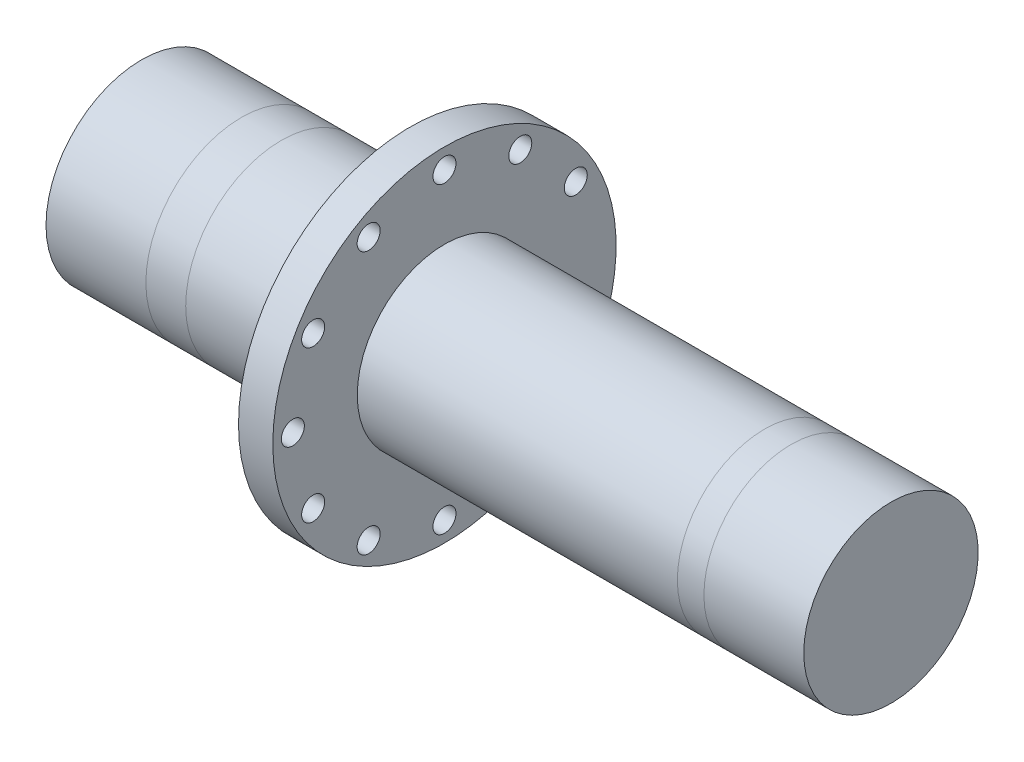
from build123d import *

# Parameters (mm, degrees)
M6_CLEARANCE_HOLE1_D = 6.6


with BuildPart() as part:
    # Sketch1 → Revolve1 (revolve)
    with BuildSketch(Plane(origin=(0, 0, 0), x_dir=(1, 0, 0), z_dir=(0, 1, 0)), mode=Mode.PRIVATE) as revolve1_sk:
        Polygon((0, 0), (215, 0), (215, 25.019), (148.198, 25.019), (86.8925, 25.019), (86.8925, 49.25), (77.05, 49.25), (77.05, 27.432), (0, 27.432), align=None)
    revolve(revolve1_sk.sketch.rotate(Axis((0, 0, 0), (1, 0, 0)), 180), axis=Axis((0, 0, 0), (1, 0, 0)))

    # M6 Clearance Hole1 (through all)
    with Locations(Plane(origin=(77.05, -25.41686526, -173.860891127), x_dir=(0, 0.3426508024612423, 0.9394628399104814), z_dir=(-1, 0, 0))):
        with Locations((129.200757828, -43.220313279), (138.703261819, -63.634261455), (157.139645763, -76.562007172), (179.56989547, -78.539571404), (199.983843646, -69.037067413), (212.911589362, -50.60068347), (214.889153595, -28.170433763), (205.386649604, -7.756485587), (186.95026566, 5.17126013), (164.520015953, 7.148824362), (144.106067777, -2.353679629)):
            Hole(M6_CLEARANCE_HOLE1_D / 2)


solid = part.part
